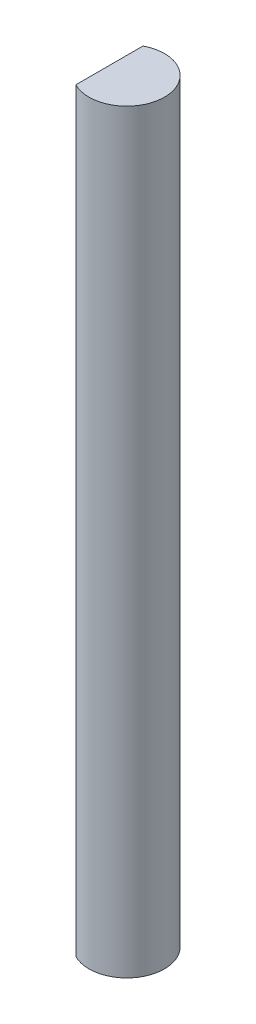
from build123d import *

# Parameters (mm, degrees)
BOSS_EXTRUDE1_DEPTH = 76.2


with BuildPart() as part:
    # Sketch1 → Boss-Extrude1 (new body)
    with BuildSketch(Plane(origin=(0, 0, 0), x_dir=(1, 0, 0), z_dir=(0, 1, 0))):
        with BuildLine():
            ThreePointArc((1.040198824, 0), (-0.787014311, 3.253406868), (-4.516051176, 3.38625323))
            Line((-4.516051176, 3.38625323), (-4.516051176, 0))
            Line((-4.516051176, 0), (1.040198824, 0))
        make_face()
        with BuildLine():
            Line((1.040198824, 0), (-4.516051176, 0))
            Line((-4.516051176, 0), (-4.516051176, -3.38625323))
            ThreePointArc((-4.516051176, -3.38625323), (-0.787014311, -3.253406868), (1.040198824, 0))
        make_face()
    extrude(amount=BOSS_EXTRUDE1_DEPTH)


solid = part.part
